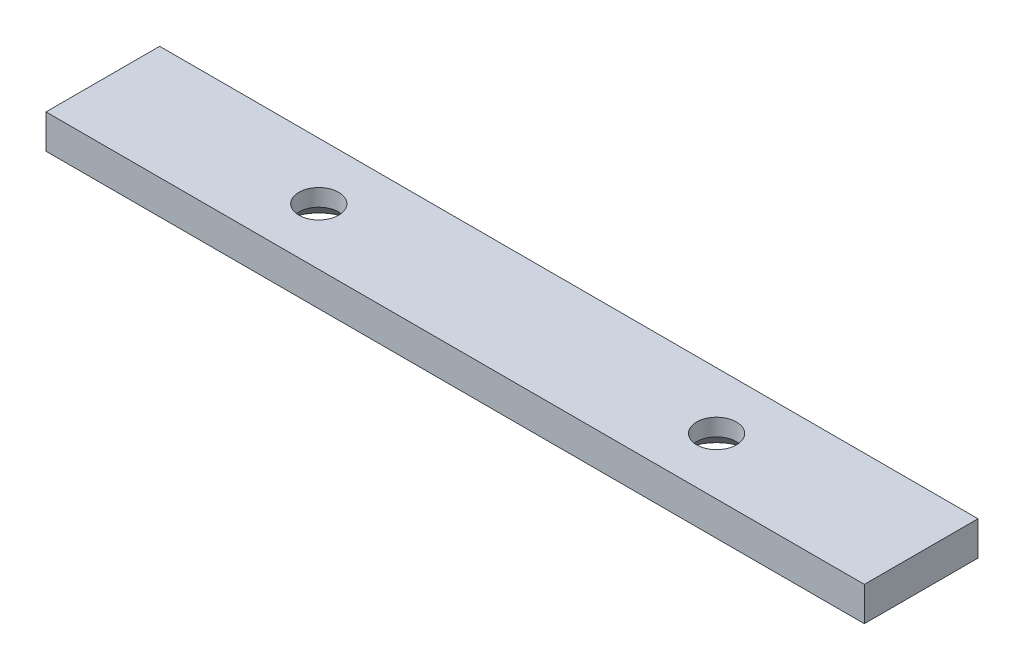
from build123d import *

# Parameters (mm, degrees)
SKETCH2_W           = 144
SKETCH2_H           = 20
BOSS_EXTRUDE1_DEPTH = 3
SKETCH2_3_R         = 3.5
CUT_EXTRUDE1_DEPTH  = 73.753006811
CUT_EXTRUDE1_TAPER  = -45
SKETCH3_R           = 3.5
CUT_EXTRUDE2_DEPTH  = 73.753006815


with BuildPart() as part:
    # Sketch2 → Boss-Extrude1 (new, symmetric)
    with BuildSketch(Plane(origin=(0, 0, 0), x_dir=(1, 0, 0), z_dir=(0, 1, 0))):
        Rectangle(SKETCH2_W, SKETCH2_H)
    extrude(amount=BOSS_EXTRUDE1_DEPTH, both=True)

    # Sketch2<3> → Cut-Extrude1 (cut, through all)
    with BuildSketch(Plane(origin=(0, 0, 0), x_dir=(1, 0, 0), z_dir=(0, 1, 0))):
        with Locations((-34, 0)):
            Circle(SKETCH2_3_R)
        with Locations((36, 0)):
            Circle(SKETCH2_3_R)
    extrude(amount=-CUT_EXTRUDE1_DEPTH, taper=CUT_EXTRUDE1_TAPER, mode=Mode.SUBTRACT)

    # Sketch3 → Cut-Extrude2 (cut, through all)
    with BuildSketch(Plane.XZ):
        with Locations((36, 0)):
            Circle(SKETCH3_R)
        with Locations((-34, 0)):
            Circle(SKETCH3_R)
    extrude(amount=-CUT_EXTRUDE2_DEPTH, mode=Mode.SUBTRACT)


solid = part.part
